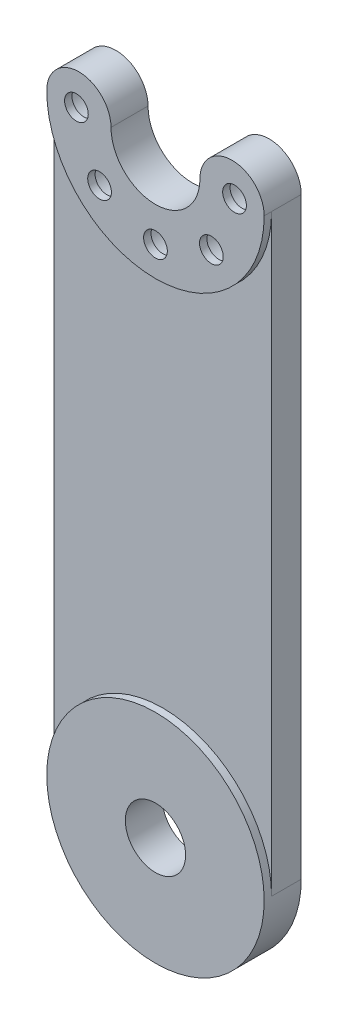
from build123d import *

# Parameters (mm, degrees)
RESSALTO_EXTRUS_O1_DEPTH          = 0.75
RESSALTO_EXTRUS_O2_DEPTH          = 3
REBAIXO_PARA_SHCS_M21_D           = 2.4
REBAIXO_PARA_SHCS_M21_CBORE_D     = 4.4
REBAIXO_PARA_SHCS_M21_CBORE_DEPTH = 3
RESSALTO_EXTRUS_O3_START          = 0.75
ESBO_O4_R                         = 11
RESSALTO_EXTRUS_O3_DEPTH          = 0.75
ESBO_O5_R                         = 3.05
CORTE_EXTRUS_O1_DEPTH             = 72.944857356


with BuildPart() as part:
    # Esboço1 → Ressalto-extrusão1 (new body)
    with BuildSketch(Plane.XY):
        with BuildLine():
            ThreePointArc((-4.5, 0), (0, -4.5), (4.5, 0))
            ThreePointArc((4.5, 0), (7.75, 3.25), (11, 0))
            ThreePointArc((11, 0), (0, -11), (-11, 0))
            ThreePointArc((-11, 0), (-7.75, 3.25), (-4.5, 0))
        make_face()
    extrude(amount=-RESSALTO_EXTRUS_O1_DEPTH)

    # Esboço3 → Ressalto-extrusão2 (add)
    with BuildSketch(Plane(origin=(0, 0, -0.75), x_dir=(-1, 0, 0), z_dir=(0, 0, -1))):
        with BuildLine():
            Line((-11, 0), (-11, -60))
            ThreePointArc((-11, -60), (0, -71), (11, -60))
            Line((11, -60), (11, 0))
            ThreePointArc((11, 0), (7.75, 3.25), (4.5, 0))
            ThreePointArc((4.5, 0), (0, -4.5), (-4.5, 0))
            ThreePointArc((-4.5, 0), (-7.75, 3.25), (-11, 0))
        make_face()
    extrude(amount=RESSALTO_EXTRUS_O2_DEPTH)

    # Rebaixo para SHCS M21 (through all)
    with Locations(Plane(origin=(0, 0, -3.75), x_dir=(-1, 0, 0), z_dir=(0, 0, -1))):
        with Locations((-8, 0), (-5.656854249, -5.656854249), (0, -8), (5.656854249, -5.656854249), (8, 0)):
            CounterBoreHole(REBAIXO_PARA_SHCS_M21_D / 2, REBAIXO_PARA_SHCS_M21_CBORE_D / 2, REBAIXO_PARA_SHCS_M21_CBORE_DEPTH)

    # Esboço4 → Ressalto-extrusão3 (add)
    with BuildSketch(Plane.XY.offset(-0.75).offset(RESSALTO_EXTRUS_O3_START)):
        with Locations((0, -60)):
            Circle(ESBO_O4_R)
    extrude(amount=-RESSALTO_EXTRUS_O3_DEPTH)

    # Esboço5 → Corte-extrusão1 (cut, through all)
    with BuildSketch(Plane(origin=(0, 0, -3.75), x_dir=(-1, 0, 0), z_dir=(0, 0, -1))):
        with Locations((0, -60)):
            Circle(ESBO_O5_R)
    extrude(amount=-CORTE_EXTRUS_O1_DEPTH, mode=Mode.SUBTRACT)


solid = part.part
